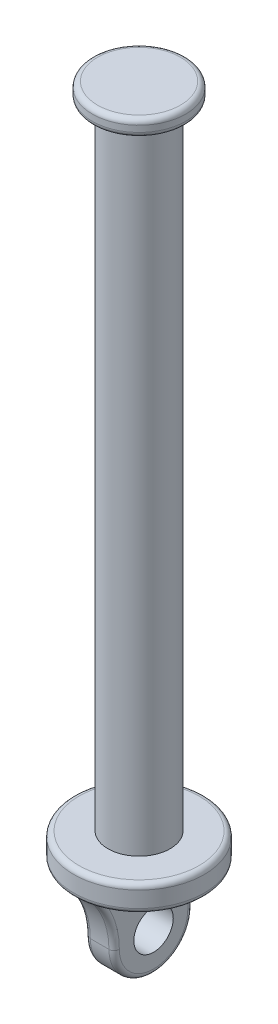
from build123d import *

# Parameters (mm, degrees)
SKETCH1_R           = 15
BOSS_EXTRUDE1_DEPTH = 305
SKETCH2_R           = 22.5
BOSS_EXTRUDE2_DEPTH = 8
SKETCH3_R           = 31.5
BOSS_EXTRUDE3_DEPTH = 12.7
SKETCH4_R           = 9.5
BOSS_EXTRUDE4_DEPTH = 7
FILLET3_R           = 2.5
FILLET4_R           = 2.5
FILLET5_R           = 2.5


with BuildPart() as part:
    # Sketch1 → Boss-Extrude1 (new body)
    with BuildSketch(Plane(origin=(0, 0, 0), x_dir=(1, 0, 0), z_dir=(0, 1, 0))):
        with Locations(Location((0, 0, 0), (0, 0, 270))):
            Circle(SKETCH1_R)
    extrude(amount=BOSS_EXTRUDE1_DEPTH)

    # Sketch2 → Boss-Extrude2 (add)
    with BuildSketch(Plane(origin=(0, 305, 0), x_dir=(1, 0, 0), z_dir=(0, 1, 0))):
        with Locations(Location((0, 0, 0), (0, 0, 270))):
            Circle(SKETCH2_R)
    extrude(amount=BOSS_EXTRUDE2_DEPTH)

    # Sketch3 → Boss-Extrude3 (add)
    with BuildSketch(Plane.XZ):
        with Locations(Location((0, 0, 0), (0, 0, 270))):
            Circle(SKETCH3_R)
    extrude(amount=BOSS_EXTRUDE3_DEPTH)

    # Sketch4 → Boss-Extrude4 (add, symmetric)
    with BuildSketch(Plane(origin=(0, 0, 0), x_dir=(0, 0, -1), z_dir=(1, 0, 0))):
        with BuildLine():
            Line((-28.5, -12.7), (28.5, -12.7))
            ThreePointArc((28.5, -12.7), (21.470051482, -24.357649102), (18.999946854, -37.744939413))
            ThreePointArc((18.999946854, -37.744939413), (0, -56.7), (-18.999946854, -37.744939413))
            ThreePointArc((-18.999946854, -37.744939413), (-21.470051482, -24.357649102), (-28.5, -12.7))
        make_face()
        with Locations((0, -37.7)):
            Circle(SKETCH4_R, mode=Mode.SUBTRACT)
    extrude(amount=BOSS_EXTRUDE4_DEPTH, both=True)

    # Fillet3
    fillet3_edges = [part.edges().sort_by_distance(p)[0] for p in [
        (7, -24.357649102, 21.470051482),
        (7, -56.7, 0),
        (7, -24.357649102, -21.470051482),
        (0, 305, -22.5),
        (0, 313, -22.5),
    ]]
    fillet(fillet3_edges, radius=FILLET3_R)

    # Fillet4
    fillet4_edges = [part.edges().sort_by_distance(p)[0] for p in [
        (-7, -24.357649102, 21.470051482),
        (-7, -56.7, 0),
        (-7, -24.357649102, -21.470051482),
    ]]
    fillet(fillet4_edges, radius=FILLET4_R)

    # Fillet5
    fillet5_edges = [part.edges().sort_by_distance(p)[0] for p in [
        (0, 0, 31.5),
        (0, -12.7, 31.5),
    ]]
    fillet(fillet5_edges, radius=FILLET5_R)


solid = part.part
